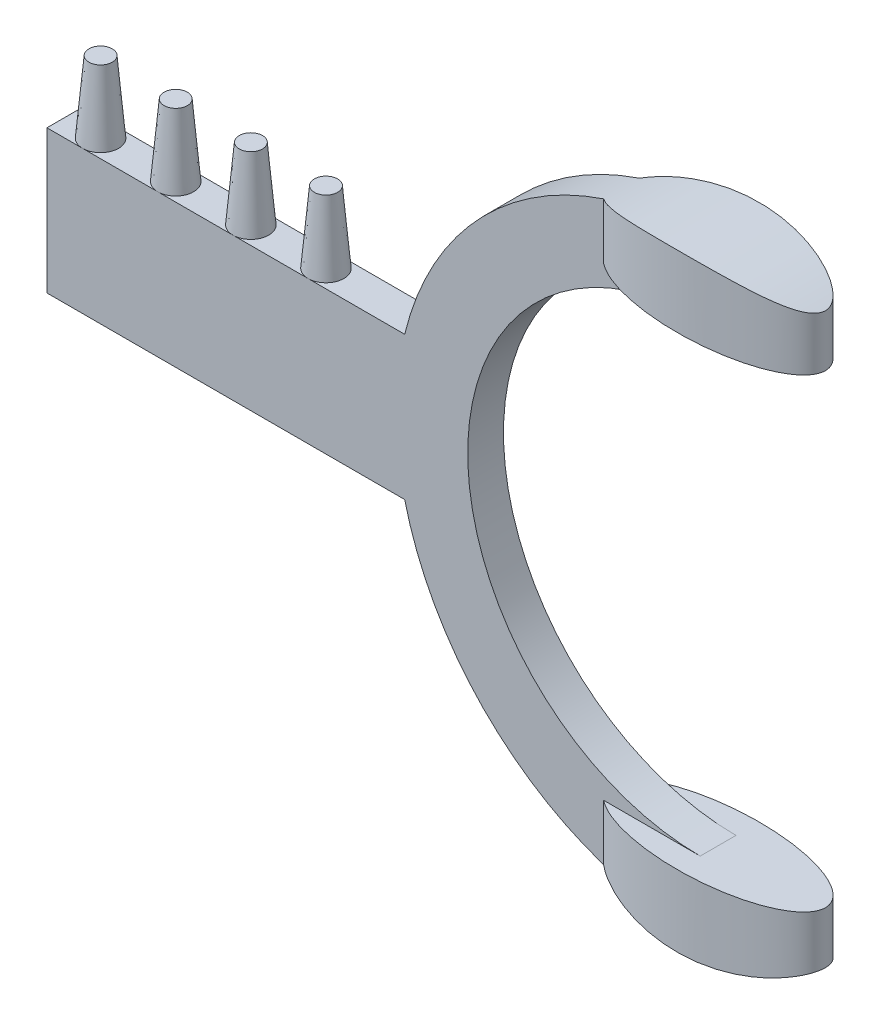
from build123d import *

# Parameters (mm, degrees)
BOSS_EXTRUDE1_DEPTH           = 0.5
SKETCH2_R                     = 0.5
BOSS_EXTRUDE2_DEPTH           = 2
BOSS_EXTRUDE2_DRAFT           = 5
BOSS_EXTRUDE2_PROFILE_2_DEPTH = 2
BOSS_EXTRUDE2_PROFILE_2_DRAFT = 5
BOSS_EXTRUDE2_PROFILE_3_DEPTH = 2
BOSS_EXTRUDE2_PROFILE_3_DRAFT = 5
BOSS_EXTRUDE2_PROFILE_4_DEPTH = 2
BOSS_EXTRUDE2_PROFILE_4_DRAFT = 5
BOSS_EXTRUDE3_REACH           = 25.637
BOSS_EXTRUDE3_END_RADIUS      = 8.5
SKETCH5_RX                    = 3
SKETCH5_RY                    = 1.15


with BuildPart() as part:
    # Sketch1 → Boss-Extrude1 (new, symmetric)
    with BuildSketch(Plane.XY):
        with BuildLine():
            Line((-8.261355821, 2), (-18.261355821, 2))
            Line((-18.261355821, 2), (-18.261355821, -2))
            Line((-18.261355821, -2), (-8.261355821, -2))
            ThreePointArc((-8.261355821, -2), (-8.5, 0), (-8.261355821, 2))
        make_face()
        with BuildLine():
            Line((-5.94e-07, 8.5), (-5.94e-07, 6.5))
            ThreePointArc((-5.94e-07, 6.5), (-6.5, 0), (-5.94e-07, -6.5))
            Line((-5.94e-07, -6.5), (-5.94e-07, -8.5))
            ThreePointArc((-5.94e-07, -8.5), (-8.5, 0), (-5.94e-07, 8.5))
        make_face()
        with BuildLine():
            ThreePointArc((-5.94e-07, 8.5), (-0.626706342, 8.476864937), (-1.250000594, 8.407585772))
            Line((-1.250000594, 8.407585772), (-1.250000594, 6.5))
            Line((-1.250000594, 6.5), (-5.94e-07, 6.5))
            Line((-5.94e-07, 6.5), (-5.94e-07, 8.5))
        make_face()
        with BuildLine():
            Line((-1.250000594, -6.5), (-1.250000594, -8.407585772))
            ThreePointArc((-1.250000594, -8.407585772), (-0.626706342, -8.476864937), (-5.94e-07, -8.5))
            Line((-5.94e-07, -8.5), (-5.94e-07, -6.5))
            Line((-5.94e-07, -6.5), (-1.250000594, -6.5))
        make_face()
    extrude(amount=BOSS_EXTRUDE1_DEPTH, both=True)


with BuildPart() as boss_extrude2_tool:
    # Sketch2 → Boss-Extrude2 (with draft: the straight prism first)
    with BuildSketch(Plane(origin=(0, 2, 0), x_dir=(1, 0, 0), z_dir=(0, 1, 0))):
        with Locations((-17.261355821, 0)):
            Circle(SKETCH2_R)
    extrude(amount=BOSS_EXTRUDE2_DEPTH)
    # Boss-Extrude2: the draft: its side faces are tilted about the plane it starts from
    boss_extrude2_sides = [boss_extrude2_tool.faces().sort_by_distance(p)[0] for p in [
        (-17.761355821, 3, 0),
    ]]
    draft(boss_extrude2_sides, Plane(origin=(0, 2, 0), x_dir=(1, 0, 0), z_dir=(0, 1, 0)), BOSS_EXTRUDE2_DRAFT)


with BuildPart() as part_1:
    add(part.part)

    # Boss-Extrude2: add boss_extrude2_tool
    add(boss_extrude2_tool.part)


with BuildPart() as boss_extrude2_profile_2_tool:
    # Sketch2 → Boss-Extrude2 profile 2 (with draft: the straight prism first)
    with BuildSketch(Plane(origin=(0, 2, 0), x_dir=(1, 0, 0), z_dir=(0, 1, 0))):
        with Locations((-15.161355821, 0)):
            Circle(SKETCH2_R)
    extrude(amount=BOSS_EXTRUDE2_PROFILE_2_DEPTH)
    # Boss-Extrude2 profile 2: the draft: its side faces are tilted about the plane it starts from
    boss_extrude2_profile_2_sides = [boss_extrude2_profile_2_tool.faces().sort_by_distance(p)[0] for p in [
        (-15.661355821, 3, 0),
    ]]
    draft(boss_extrude2_profile_2_sides, Plane(origin=(0, 2, 0), x_dir=(1, 0, 0), z_dir=(0, 1, 0)), BOSS_EXTRUDE2_PROFILE_2_DRAFT)


with BuildPart() as part_2:
    add(part_1.part)

    # Boss-Extrude2 profile 2: add boss_extrude2_profile_2_tool
    add(boss_extrude2_profile_2_tool.part)


with BuildPart() as boss_extrude2_profile_3_tool:
    # Sketch2 → Boss-Extrude2 profile 3 (with draft: the straight prism first)
    with BuildSketch(Plane(origin=(0, 2, 0), x_dir=(1, 0, 0), z_dir=(0, 1, 0))):
        with Locations((-13.061355821, 0)):
            Circle(SKETCH2_R)
    extrude(amount=BOSS_EXTRUDE2_PROFILE_3_DEPTH)
    # Boss-Extrude2 profile 3: the draft: its side faces are tilted about the plane it starts from
    boss_extrude2_profile_3_sides = [boss_extrude2_profile_3_tool.faces().sort_by_distance(p)[0] for p in [
        (-13.561355821, 3, 0),
    ]]
    draft(boss_extrude2_profile_3_sides, Plane(origin=(0, 2, 0), x_dir=(1, 0, 0), z_dir=(0, 1, 0)), BOSS_EXTRUDE2_PROFILE_3_DRAFT)


with BuildPart() as part_3:
    add(part_2.part)

    # Boss-Extrude2 profile 3: add boss_extrude2_profile_3_tool
    add(boss_extrude2_profile_3_tool.part)


with BuildPart() as boss_extrude2_profile_4_tool:
    # Sketch2 → Boss-Extrude2 profile 4 (with draft: the straight prism first)
    with BuildSketch(Plane(origin=(0, 2, 0), x_dir=(1, 0, 0), z_dir=(0, 1, 0))):
        with Locations((-10.961355821, 0)):
            Circle(SKETCH2_R)
    extrude(amount=BOSS_EXTRUDE2_PROFILE_4_DEPTH)
    # Boss-Extrude2 profile 4: the draft: its side faces are tilted about the plane it starts from
    boss_extrude2_profile_4_sides = [boss_extrude2_profile_4_tool.faces().sort_by_distance(p)[0] for p in [
        (-11.461355821, 3, 0),
    ]]
    draft(boss_extrude2_profile_4_sides, Plane(origin=(0, 2, 0), x_dir=(1, 0, 0), z_dir=(0, 1, 0)), BOSS_EXTRUDE2_PROFILE_4_DRAFT)


with BuildPart() as part_4:
    add(part_3.part)

    # Boss-Extrude2 profile 4: add boss_extrude2_profile_4_tool
    add(boss_extrude2_profile_4_tool.part)

    # Boss-Extrude3: up to this cylinder (the profile starts inside it)
    boss_extrude3_end = Plane(origin=(0, 0, 0), z_dir=(0, 0, -1)) * Cylinder(BOSS_EXTRUDE3_END_RADIUS, 69.274, mode=Mode.PRIVATE)
    # Sketch5 → Boss-Extrude3 (add, up to the surface)
    with BuildSketch(Plane(origin=(0, 6.5, 0), x_dir=(1, 0, 0), z_dir=(0, 1, 0)), mode=Mode.PRIVATE) as boss_extrude3_sk1:
        with Locations((0, 0)):
            Ellipse(SKETCH5_RX, SKETCH5_RY)
    boss_extrude3_tool1 = extrude(boss_extrude3_sk1.sketch, amount=BOSS_EXTRUDE3_REACH, mode=Mode.PRIVATE) & boss_extrude3_end
    boss_extrude3 = boss_extrude3_tool1.solids().sort_by_distance((0, 6.5, 0))[0]
    add(boss_extrude3)

    # Mirror1: Boss-Extrude3 across plane
    add(boss_extrude3.mirror(Plane.ZX))


solid = part_4.part
